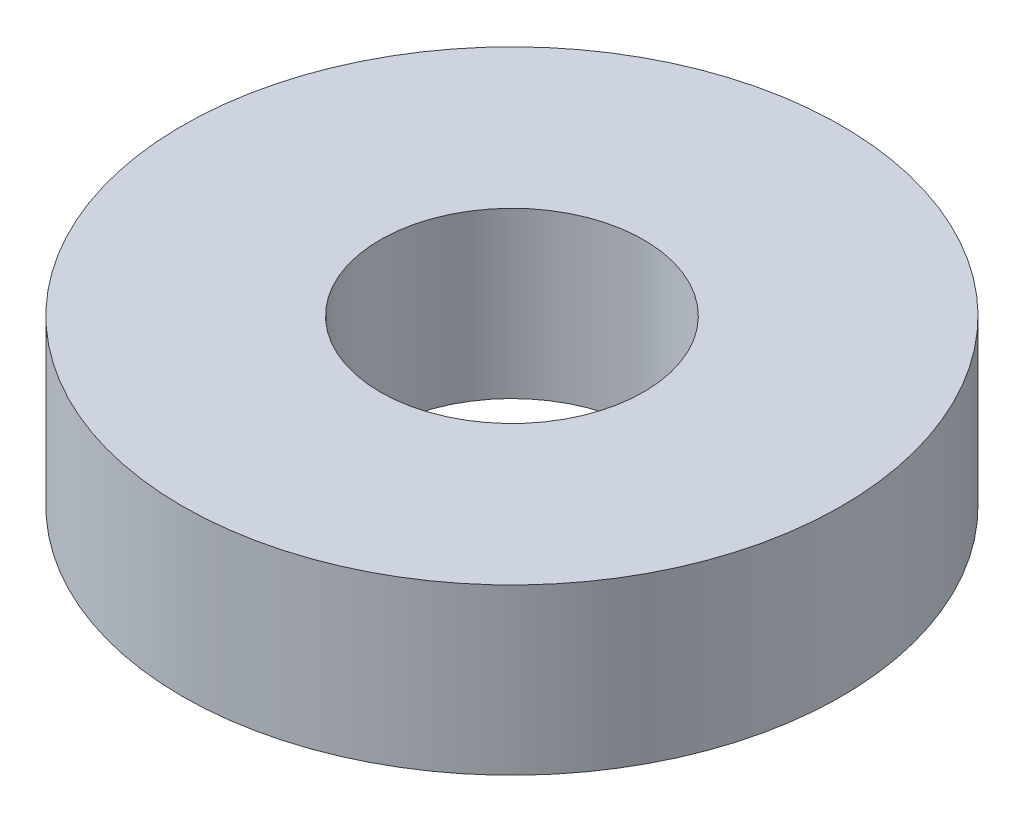
from build123d import *

# Parameters (mm, degrees)
SKETCH1_R           = 5
SKETCH1_R_2         = 2
BOSS_EXTRUDE1_DEPTH = 2.5


with BuildPart() as part:
    # Sketch1 → Boss-Extrude1 (new body)
    with BuildSketch(Plane(origin=(0, 0, 0), x_dir=(1, 0, 0), z_dir=(0, 1, 0))):
        with Locations(Location((0, 0, 0), (0, 0, 270))):
            Circle(SKETCH1_R)
        with Locations(Location((0, 0, 0), (0, 0, 270))):
            Circle(SKETCH1_R_2, mode=Mode.SUBTRACT)
    extrude(amount=BOSS_EXTRUDE1_DEPTH)


solid = part.part
